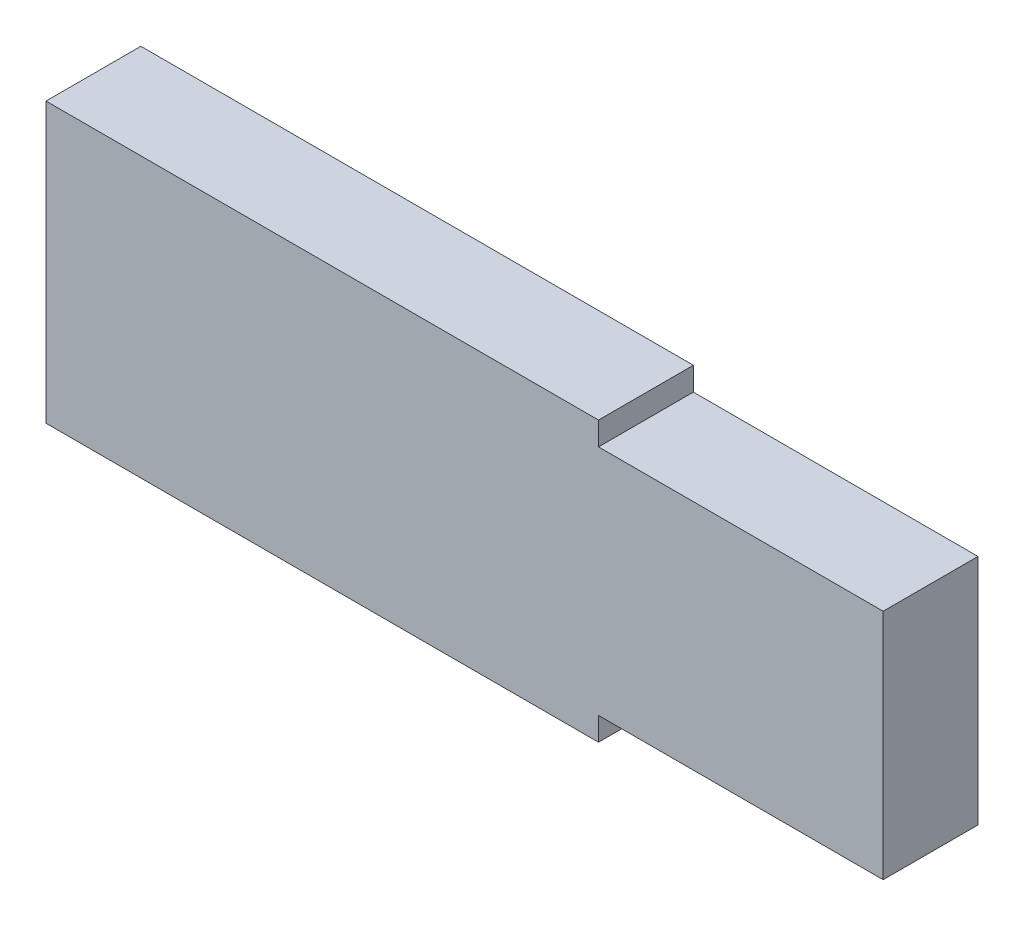
from build123d import *

# Parameters (mm, degrees)
BOSS_EXTRUDE2_DEPTH = 5.1


with BuildPart() as part:
    # Sketch1 → Boss-Extrude2 (new body)
    with BuildSketch(Plane.XY):
        Polygon((80, -7.5), (50.3, -7.5), (50.3, 7.5), (80, 7.5), (80, 6.25), (95.3, 6.25), (95.3, -6.25), (80, -6.25), align=None)
    extrude(amount=BOSS_EXTRUDE2_DEPTH)


solid = part.part
